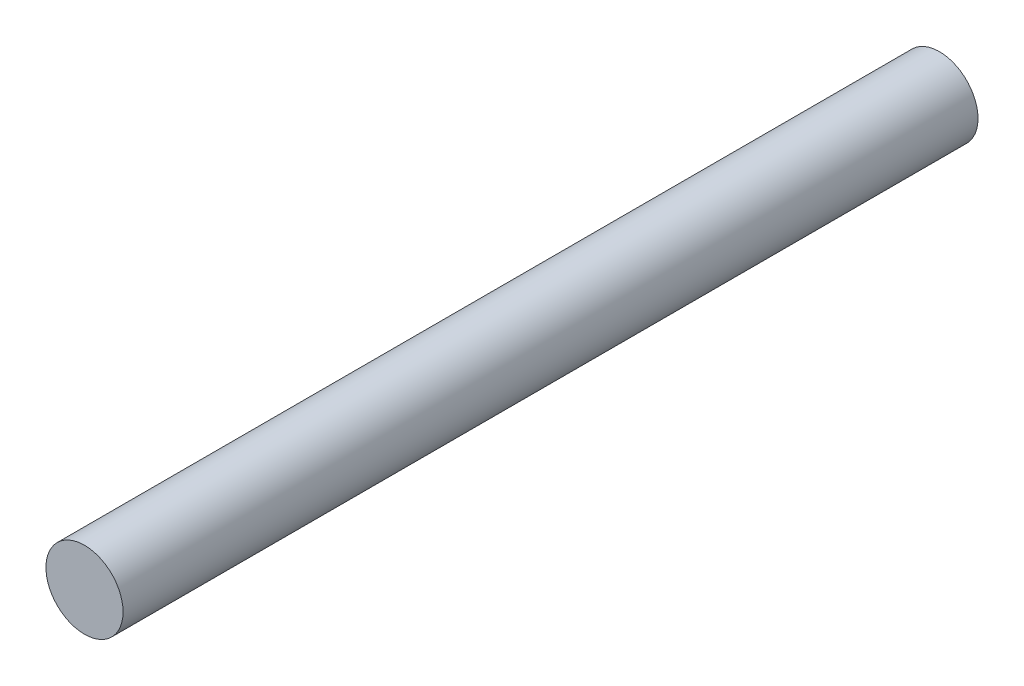
from build123d import *

# Parameters (mm, degrees)
SKETCH1_R           = 0.3
BOSS_EXTRUDE1_DEPTH = 6.65


with BuildPart() as part:
    # Sketch1 → Boss-Extrude1 (new body)
    with BuildSketch(Plane.XY):
        Circle(SKETCH1_R)
    extrude(amount=BOSS_EXTRUDE1_DEPTH)


solid = part.part
